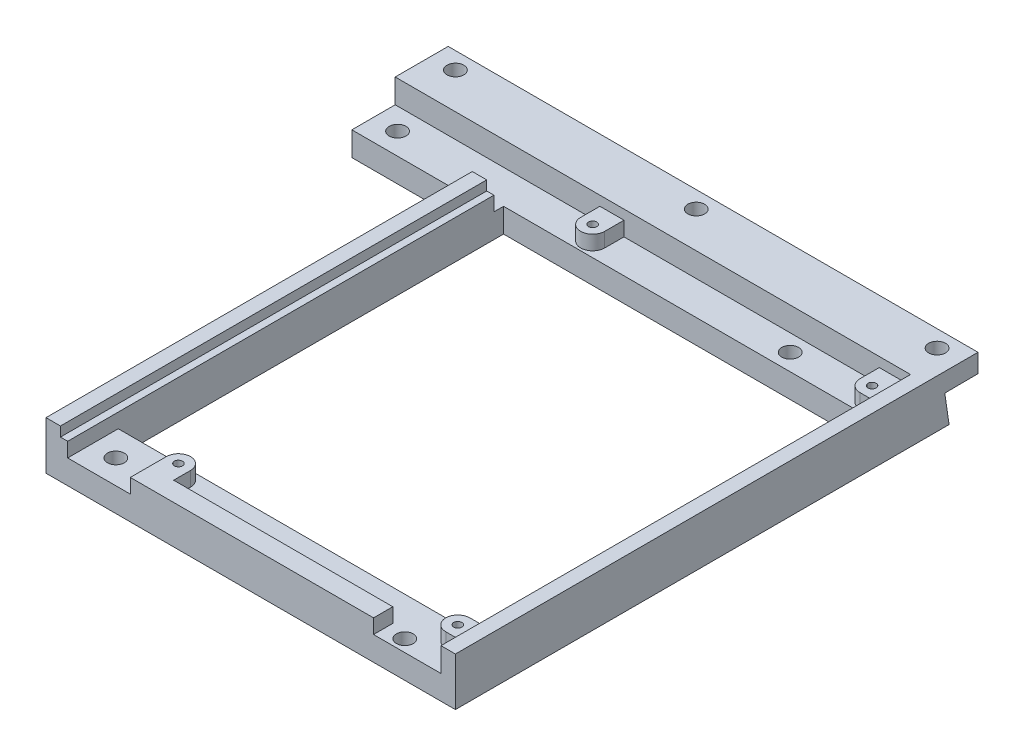
from build123d import *

# Parameters (mm, degrees)
SKETCH_2_W          = 110
SKETCH_2_H          = 108.5
EXTRUDE_1_DEPTH     = 10
CUT_EXTRUDE_1_DEPTH = 124.057151357
SKETCH_4_W          = 25
SKETCH_4_H          = 88.5
CUT_EXTRUDE_2_DEPTH = 78.897769544
CUT_EXTRUDE_3_DEPTH = 2
SKETCH_6_W          = 76
SKETCH_6_H          = 80
CUT_EXTRUDE_4_DEPTH = 78.666353719
CUT_EXTRUDE_5_DEPTH = 3
SKETCH_8_R          = 0.85
SKETCH_8_R_2        = 1.75
CUT_EXTRUDE_6_DEPTH = 78.666353719
SKETCH_9_R          = 1.75
CUT_EXTRUDE_7_DEPTH = 78.897769544


with BuildPart() as part:
    # 스케치2 → 보스-돌출1 (new body)
    with BuildSketch(Plane(origin=(0, 0, 0), x_dir=(1, 0, 0), z_dir=(0, 1, 0))):
        Rectangle(SKETCH_2_W, SKETCH_2_H)
    extrude(amount=EXTRUDE_1_DEPTH)

    # 스케치3 → 컷-돌출1 (cut, through all)
    with BuildSketch(Plane.ZY.offset(55)):
        Polygon((-54.25, 6.15), (-47.351234773, 6.104845063), (-48.25, 0), (-54.25, 0), align=None)
    extrude(amount=-CUT_EXTRUDE_1_DEPTH, mode=Mode.SUBTRACT)

    # 스케치4 → 컷-돌출2 (cut, through all)
    with BuildSketch(Plane(origin=(0, 10, 0), x_dir=(1, 0, 0), z_dir=(0, 1, 0))):
        with Locations((-42.5, -10)):
            Rectangle(SKETCH_4_W, SKETCH_4_H)
    extrude(amount=-CUT_EXTRUDE_2_DEPTH, mode=Mode.SUBTRACT)

    # 스케치5 → 컷-돌출3 (cut)
    with BuildSketch(Plane(origin=(0, 10, 0), x_dir=(1, 0, 0), z_dir=(0, 1, 0))):
        Polygon((52, -54.25), (-27, -54.25), (-27, 34.25), (-55, 34.25), (-55, 43.25), (52, 43.25), align=None)
    extrude(amount=-CUT_EXTRUDE_3_DEPTH, mode=Mode.SUBTRACT)

    # 스케치6 → 컷-돌출4 (cut, through all)
    with BuildSketch(Plane(origin=(0, 8, 0), x_dir=(1, 0, 0), z_dir=(0, 1, 0))):
        with Locations((12.5, -3.75)):
            Rectangle(SKETCH_6_W, SKETCH_6_H)
    extrude(amount=-CUT_EXTRUDE_4_DEPTH, mode=Mode.SUBTRACT)

    # 스케치7 → 컷-돌출5 (cut)
    with BuildSketch(Plane(origin=(0, 8, 0), x_dir=(1, 0, 0), z_dir=(0, 1, 0))):
        with BuildLine():
            Line((52, -54.25), (38, -54.25))
            Line((38, -54.25), (38, -50.25))
            Line((38, -50.25), (-7.5, -50.25))
            Line((-7.5, -50.25), (-7.5, -46.75))
            ThreePointArc((-7.5, -46.75), (-10, -44.25), (-12.5, -46.75))
            Line((-12.5, -46.75), (-12.5, -54.25))
            Line((-12.5, -54.25), (-25.5, -54.25))
            Line((-25.5, -54.25), (-25.5, 34.25))
            Line((-25.5, 34.25), (-55, 34.25))
            Line((-55, 34.25), (-55, 43.25))
            Line((-55, 43.25), (-12.5, 43.25))
            Line((-12.5, 43.25), (-12.5, 39.25))
            ThreePointArc((-12.5, 39.25), (-10, 36.75), (-7.5, 39.25))
            Line((-7.5, 39.25), (-7.5, 43.25))
            Line((-7.5, 43.25), (45.5, 43.25))
            Line((45.5, 43.25), (45.5, 39.25))
            ThreePointArc((45.5, 39.25), (46.232233047, 37.482233047), (48, 36.75))
            Line((48, 36.75), (50.5, 36.75))
            Line((50.5, 36.75), (50.5, -44.25))
            Line((50.5, -44.25), (48, -44.25))
            ThreePointArc((48, -44.25), (45.5, -46.75), (48, -49.25))
            Line((48, -49.25), (52, -49.25))
            Line((52, -49.25), (52, -54.25))
        make_face()
    extrude(amount=-CUT_EXTRUDE_5_DEPTH, mode=Mode.SUBTRACT)

    # 스케치8 → 컷-돌출6 (cut, through all)
    with BuildSketch(Plane(origin=(0, 8, 0), x_dir=(1, 0, 0), z_dir=(0, 1, 0))):
        with Locations(Location((-10, 39.25, 0), (0, 0, 270))):
            Circle(SKETCH_8_R)
        with Locations(Location((48, 39.25, 0), (0, 0, 270))):
            Circle(SKETCH_8_R)
        with Locations(Location((-10, -46.75, 0), (0, 0, 270))):
            Circle(SKETCH_8_R)
        with Locations(Location((48, -46.75, 0), (0, 0, 270))):
            Circle(SKETCH_8_R)
        with Locations(Location((-50, 38.75, 0), (0, 0, 270))):
            Circle(SKETCH_8_R_2)
        with Locations(Location((30.5, 39.75, 0), (0, 0, 270))):
            Circle(SKETCH_8_R_2)
        with Locations(Location((42, -51.75, 0), (0, 0, 270))):
            Circle(SKETCH_8_R_2)
        with Locations(Location((-20.5, -49.25, 0), (0, 0, 270))):
            Circle(SKETCH_8_R_2)
    extrude(amount=-CUT_EXTRUDE_6_DEPTH, mode=Mode.SUBTRACT)

    # 스케치9 → 컷-돌출7 (cut, through all)
    with BuildSketch(Plane(origin=(0, 10, 0), x_dir=(1, 0, 0), z_dir=(0, 1, 0))):
        with Locations(Location((-50, 50.75, 0), (0, 0, 270))):
            Circle(SKETCH_9_R)
        with Locations(Location((0, 50.75, 0), (0, 0, 270))):
            Circle(SKETCH_9_R)
        with Locations(Location((50, 50.75, 0), (0, 0, 270))):
            Circle(SKETCH_9_R)
    extrude(amount=-CUT_EXTRUDE_7_DEPTH, mode=Mode.SUBTRACT)


solid = part.part
